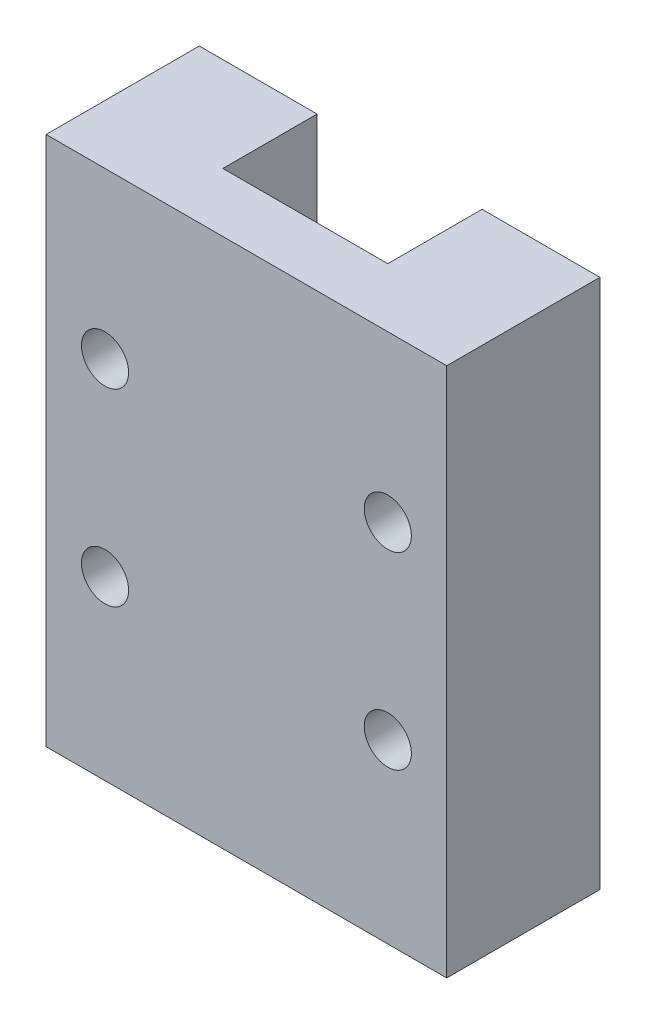
from build123d import *

# Parameters (mm, degrees)
EXTRUDE_1_DEPTH     = 22.5
SKETCH_2_R          = 1
CUT_EXTRUDE_1_DEPTH = 4


with BuildPart() as part:
    # 草图1 → 凸台-拉伸1 (new body)
    with BuildSketch(Plane(origin=(0, 0, 0), x_dir=(1, 0, 0), z_dir=(0, 1, 0))):
        Polygon((-3.5, -0.75), (3.5, -0.75), (3.5, 3.25), (8.5, 3.25), (8.5, -3.25), (-8.5, -3.25), (-8.5, 3.25), (-3.5, 3.25), align=None)
    extrude(amount=EXTRUDE_1_DEPTH)

    # 草图2 → 切除-拉伸1 (cut)
    with BuildSketch(Plane.XY.offset(3.25)):
        with Locations((-6, 15.5)):
            Circle(SKETCH_2_R)
        with Locations((-6, 7.5)):
            Circle(SKETCH_2_R)
        with Locations(Location((6, 7.5, 0), (0, 0, 180))):
            Circle(SKETCH_2_R)
        with Locations(Location((6, 15.5, 0), (0, 0, 180))):
            Circle(SKETCH_2_R)
    extrude(amount=-CUT_EXTRUDE_1_DEPTH, mode=Mode.SUBTRACT)


solid = part.part
